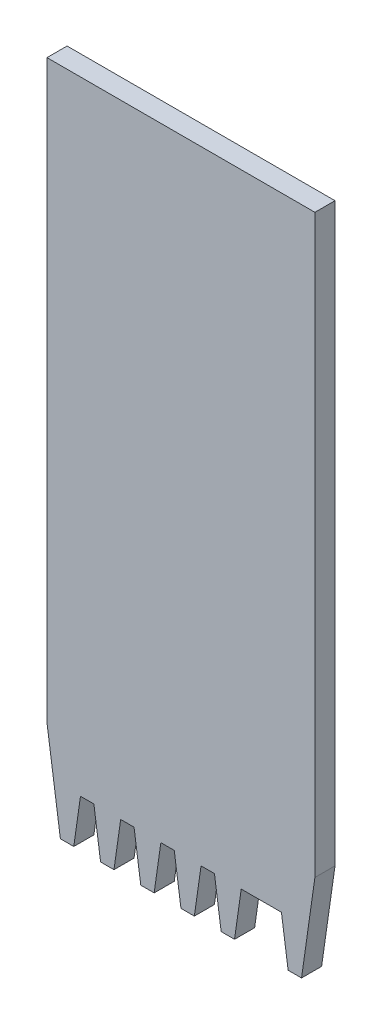
from build123d import *

# Parameters (mm, degrees)
BOSS_EXTRUDE1_DEPTH = 1.5


with BuildPart() as part:
    # Sketch1 → Boss-Extrude1 (new body)
    with BuildSketch(Plane.XY):
        Polygon((0, 7), (1, 0), (2, 0), (2.5, 3.5), (3.5, 3.5), (4, 0), (5, 0), (5.5, 3.5), (6.5, 3.5), (7, 0), (8, 0), (8.5, 3.5), (9.5, 3.5), (10, 0), (11, 0), (11.5, 3.5), (12.5, 3.5), (13, 0), (14, 0), (14.5, 3.5), (17.5, 3.5), (18, 0), (19, 0), (20, 7), (20, 50), (0, 50), align=None)
    extrude(amount=BOSS_EXTRUDE1_DEPTH)


solid = part.part
